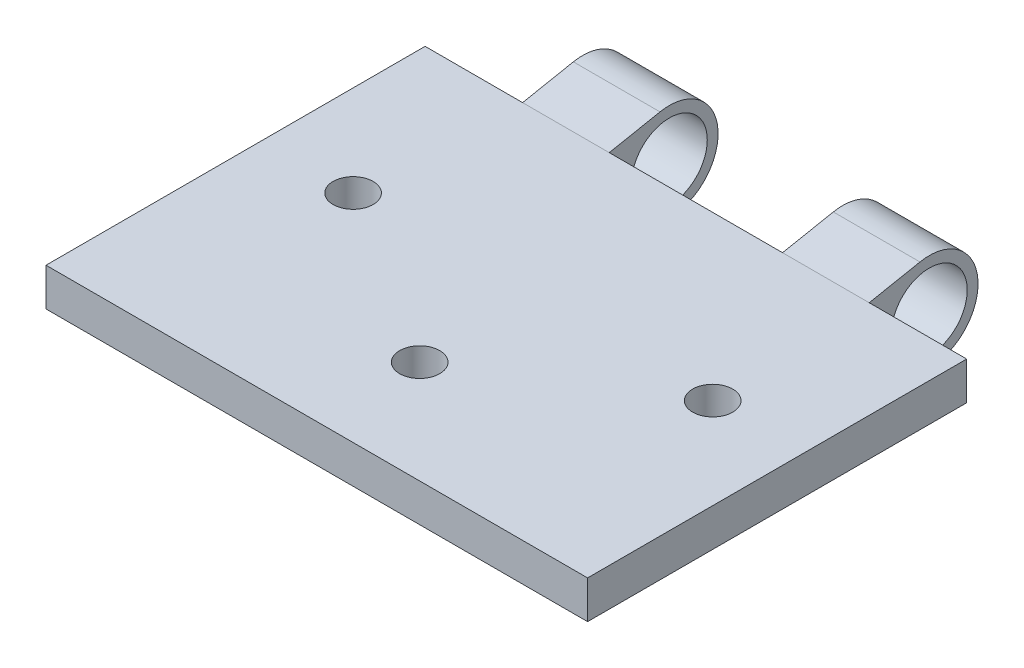
from build123d import *

# Parameters (mm, degrees)
SKETCH2_W           = 50
SKETCH2_H           = 35
BOSS_EXTRUDE1_DEPTH = 3.5
SKETCH3_R           = 1.85
CUT_EXTRUDE1_DEPTH  = 31.716445107
SKETCH5_R           = 3.5
BOSS_EXTRUDE2_DEPTH = 8


with BuildPart() as part:
    # Sketch2 → Boss-Extrude1 (new body)
    with BuildSketch(Plane(origin=(0, 0, 0), x_dir=(1, 0, 0), z_dir=(0, 1, 0))):
        Rectangle(SKETCH2_W, SKETCH2_H)
    extrude(amount=BOSS_EXTRUDE1_DEPTH)

    # Sketch3 → Cut-Extrude1 (cut, through all)
    with BuildSketch(Plane(origin=(0, 3.5, 0), x_dir=(1, 0, 0), z_dir=(0, 1, 0))):
        with Locations(Location((-16.6, 2.45, 0), (0, 0, 270))):
            Circle(SKETCH3_R)
        with Locations(Location((0, -8, 0), (0, 0, 270))):
            Circle(SKETCH3_R)
        with Locations(Location((16.6, 2.45, 0), (0, 0, 270))):
            Circle(SKETCH3_R)
    extrude(amount=-CUT_EXTRUDE1_DEPTH, mode=Mode.SUBTRACT)

    # Sketch5 → Boss-Extrude2 (add)
    with BuildSketch(Plane(origin=(8, 0, 0), x_dir=(0, 0, -1), z_dir=(1, 0, 0))):
        with BuildLine():
            Line((17.5, 3.5), (22.186446019, 4.416364401))
            ThreePointArc((22.186446019, 4.416364401), (27.235272499, -1.653328191), (19.401351351, -2.633887439))
            Line((19.401351351, -2.633887439), (17.5, 0))
            Line((17.5, 0), (17.5, 3.5))
        make_face()
        with Locations((23.05, 0)):
            Circle(SKETCH5_R, mode=Mode.SUBTRACT)
    boss_extrude2 = extrude(amount=BOSS_EXTRUDE2_DEPTH)

    # Mirror1: Boss-Extrude2 across plane
    add(boss_extrude2.mirror(Plane(origin=(0, 0, 0), x_dir=(0, 0, 1), z_dir=(1, 0, 0))))


solid = part.part
